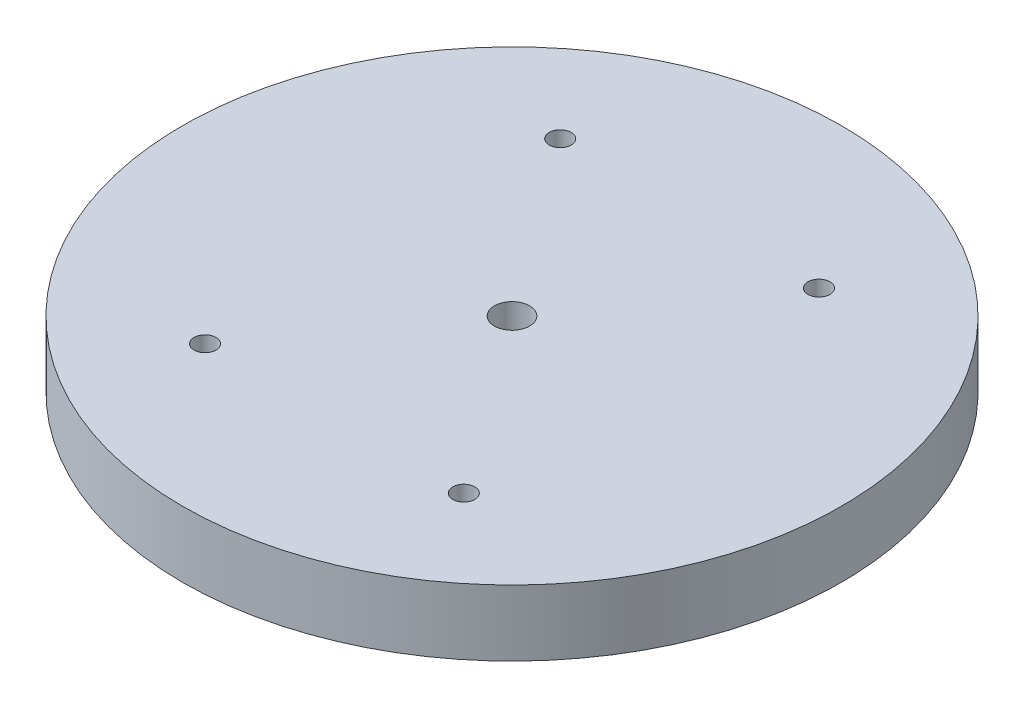
from build123d import *

# Parameters (mm, degrees)
SKETCH1_R           = 75
SKETCH1_R_2         = 2.5
BOSS_EXTRUDE1_DEPTH = 15
SKETCH2_R           = 4
CUT_EXTRUDE1_DEPTH  = 24


with BuildPart() as part:
    # Sketch1 → Boss-Extrude1 (new body)
    with BuildSketch(Plane(origin=(0, 0, 0), x_dir=(1, 0, 0), z_dir=(0, 1, 0))):
        with Locations(Location((0, 0, 0), (0, 0, 270))):
            Circle(SKETCH1_R)
        with Locations(Location((29.443587855, 40.411324331, 0), (0, 0, 270))):
            Circle(SKETCH1_R_2, mode=Mode.SUBTRACT)
        with Locations(Location((29.443587855, -40.411324331, 0), (0, 0, 90))):
            Circle(SKETCH1_R_2, mode=Mode.SUBTRACT)
        with Locations(Location((-29.443587855, -40.411324331, 0), (0, 0, 270))):
            Circle(SKETCH1_R_2, mode=Mode.SUBTRACT)
        with Locations(Location((-29.443587855, 40.411324331, 0), (0, 0, 90))):
            Circle(SKETCH1_R_2, mode=Mode.SUBTRACT)
    extrude(amount=BOSS_EXTRUDE1_DEPTH)

    # Sketch2 → Cut-Extrude1 (cut)
    with BuildSketch(Plane(origin=(0, 15, 0), x_dir=(1, 0, 0), z_dir=(0, 1, 0))):
        with Locations(Location((0, 0, 0), (0, 0, 270))):
            Circle(SKETCH2_R)
    extrude(amount=-CUT_EXTRUDE1_DEPTH, mode=Mode.SUBTRACT)


solid = part.part
